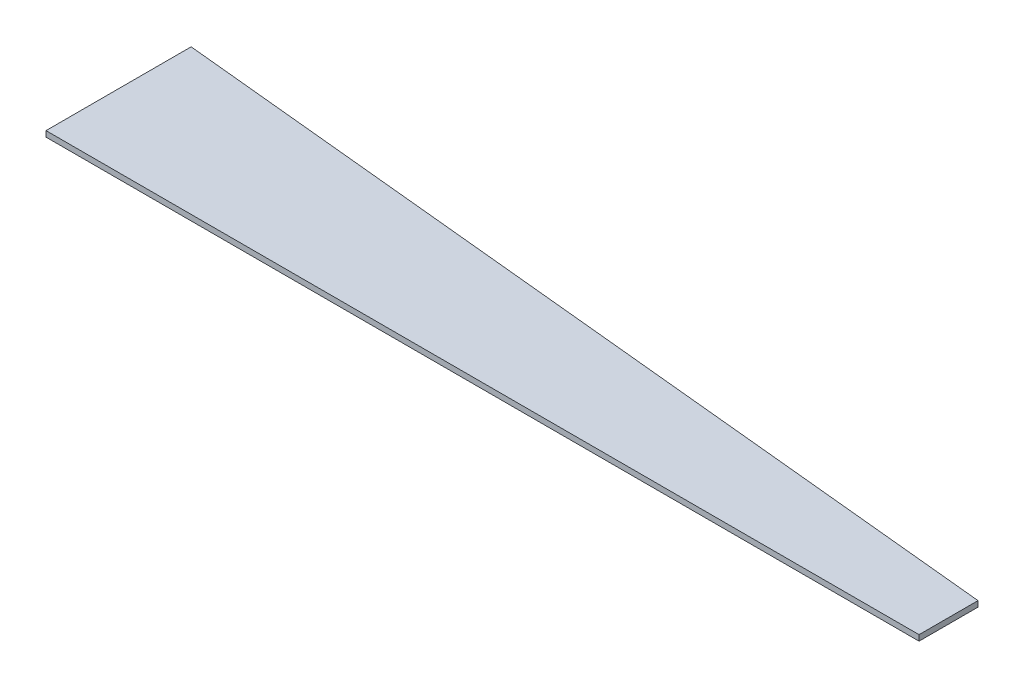
from build123d import *

# Parameters (mm, degrees)
BOSS_EXTRUDE1_DEPTH = 3.175


with BuildPart() as part:
    # Sketch1 → Boss-Extrude1 (new body)
    with BuildSketch(Plane(origin=(0, 0, 0), x_dir=(1, 0, 0), z_dir=(0, 1, 0))):
        Polygon((0, 0), (488.95, -48.26), (488.95, -81.28), (0, -81.28), align=None)
    extrude(amount=BOSS_EXTRUDE1_DEPTH)


solid = part.part
